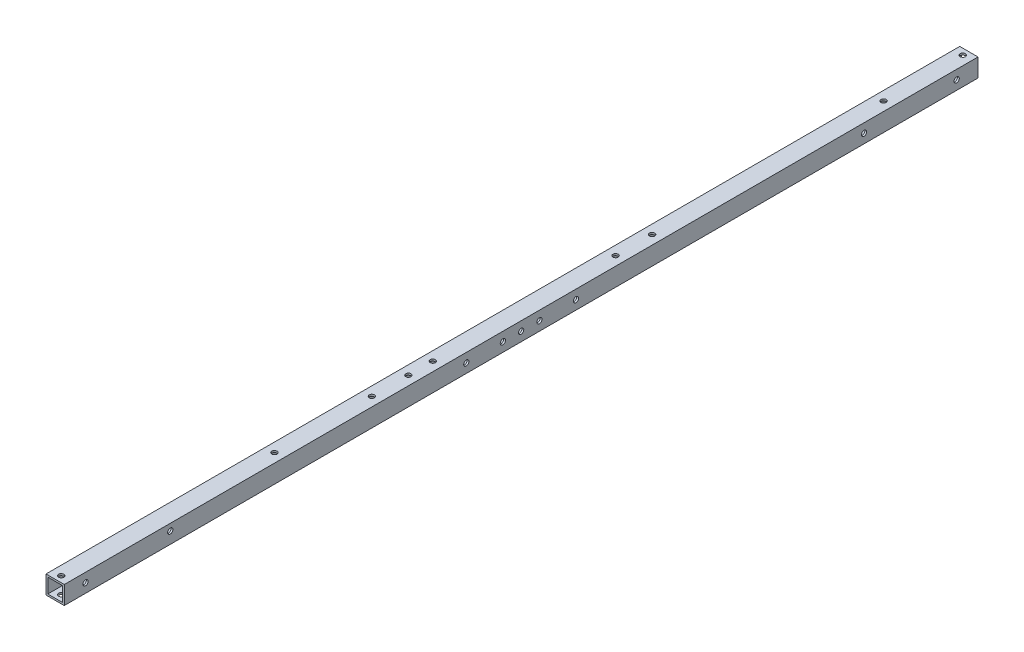
from build123d import *

# Parameters (mm, degrees)
SKETCH_1_W          = 15
SKETCH_1_H          = 15
SKETCH_1_W_2        = 12
SKETCH_1_H_2        = 12
EXTRUDE_2_DEPTH     = 750
SKETCH_3_R          = 2.15
CUT_EXTRUDE_1_DEPTH = 751.187476568
SKETCH_4_R          = 2.15
CUT_EXTRUDE_2_DEPTH = 751.187476568


with BuildPart() as part:
    # ｽｹｯﾁ1 → 押し出し-薄板2 (new body)
    with BuildSketch(Plane.XY):
        Rectangle(SKETCH_1_W, SKETCH_1_H)
        Rectangle(SKETCH_1_W_2, SKETCH_1_H_2, mode=Mode.SUBTRACT)
    extrude(amount=EXTRUDE_2_DEPTH)

    # ｽｹｯﾁ3 → ｶｯﾄ - 押し出し1 (cut, through all)
    with BuildSketch(Plane(origin=(0, 7.5, 0), x_dir=(1, 0, 0), z_dir=(0, 1, 0))):
        with Locations(Location((0, -745, 0), (0, 0, 270))):
            Circle(SKETCH_3_R)
        with Locations(Location((0, -5, 0), (0, 0, 270))):
            Circle(SKETCH_3_R)
        with Locations(Location((0, -490, 0), (0, 0, 270))):
            Circle(SKETCH_3_R)
        with Locations(Location((0, -460, 0), (0, 0, 270))):
            Circle(SKETCH_3_R)
        with Locations(Location((0, -570, 0), (0, 0, 270))):
            Circle(SKETCH_3_R)
        with Locations(Location((0, -290, 0), (0, 0, 270))):
            Circle(SKETCH_3_R)
        with Locations(Location((0, -260, 0), (0, 0, 270))):
            Circle(SKETCH_3_R)
        with Locations(Location((0, -70, 0), (0, 0, 270))):
            Circle(SKETCH_3_R)
        with Locations(Location((0, -440, 0), (0, 0, 270))):
            Circle(SKETCH_3_R)
    extrude(amount=-CUT_EXTRUDE_1_DEPTH, mode=Mode.SUBTRACT)

    # ｽｹｯﾁ4 → ｶｯﾄ - 押し出し2 (cut, through all)
    with BuildSketch(Plane(origin=(7.5, 0, 0), x_dir=(0, 0, -1), z_dir=(1, 0, 0))):
        with Locations(Location((-360, 0, 0), (0, 0, 90))):
            Circle(SKETCH_4_R)
        with Locations(Location((-390, 0, 0), (0, 0, 90))):
            Circle(SKETCH_4_R)
        with Locations(Location((-375, 0, 0), (0, 0, 90))):
            Circle(SKETCH_4_R)
        with Locations(Location((-732.5, 0, 0), (0, 0, 90))):
            Circle(SKETCH_4_R)
        with Locations(Location((-17.5, 0, 0), (0, 0, 90))):
            Circle(SKETCH_4_R)
        with Locations(Location((-420, 0, 0), (0, 0, 90))):
            Circle(SKETCH_4_R)
        with Locations(Location((-330, 0, 0), (0, 0, 90))):
            Circle(SKETCH_4_R)
        with Locations(Location((-663, 2, 0), (0, 0, 90))):
            Circle(SKETCH_4_R)
        with Locations(Location((-93.5, 0, 0), (0, 0, 90))):
            Circle(SKETCH_4_R)
    extrude(amount=-CUT_EXTRUDE_2_DEPTH, mode=Mode.SUBTRACT)


solid = part.part
